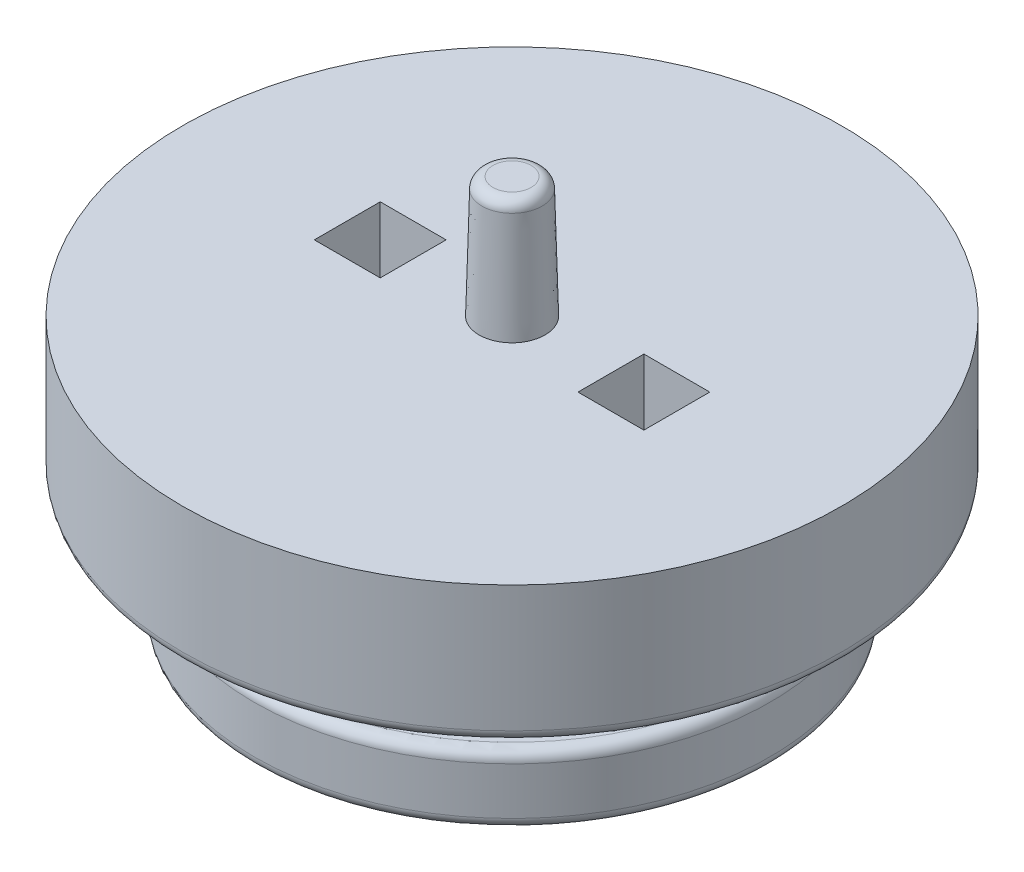
from build123d import *

# Parameters (mm, degrees)
SKETCH1_R           = 5.75
BOSS_EXTRUDE1_DEPTH = 15
SKETCH12_R          = 5.75
BOSS_EXTRUDE3_DEPTH = 2
SKETCH11_R          = 15
SKETCH11_W          = 3
SKETCH11_H          = 3
BOSS_EXTRUDE2_DEPTH = 4.25
SKETCH13_R          = 1.5
BOSS_EXTRUDE4_DEPTH = 5.5
BOSS_EXTRUDE4_TAPER = 1.5
FILLET2_R           = 0.5
BOSS_EXTRUDE5_START = -2
SKETCH11_2_R        = 15
BOSS_EXTRUDE5_DEPTH = 2
SKETCH14_R          = 11.75
BOSS_EXTRUDE6_DEPTH = 12.4
SKETCH14_2_R        = 11.75
CUT_EXTRUDE1_DEPTH  = 9.25
FILLET3_R           = 0.5


with BuildPart() as part:
    # Sketch1 → Boss-Extrude1 (new body)
    with BuildSketch(Plane(origin=(0, 0, 0), x_dir=(1, 0, 0), z_dir=(0, 1, 0))):
        with Locations(Location((0, 0, 0), (0, 0, 270))):
            Circle(SKETCH1_R)
    extrude(amount=BOSS_EXTRUDE1_DEPTH)

    # Sketch12 → Boss-Extrude3 (add)
    with BuildSketch(Plane(origin=(0, 15, 0), x_dir=(1, 0, 0), z_dir=(0, 1, 0))):
        with Locations(Location((0, 0, 0), (0, 0, 270))):
            Circle(SKETCH12_R)
    extrude(amount=BOSS_EXTRUDE3_DEPTH)

    # Sketch11 → Boss-Extrude2 (add)
    with BuildSketch(Plane(origin=(0, 17, 0), x_dir=(1, 0, 0), z_dir=(0, 1, 0))):
        with Locations(Location((0, 0, 0), (0, 0, 270))):
            Circle(SKETCH11_R)
        with Locations((-6, 0)):
            Rectangle(SKETCH11_W, SKETCH11_H, mode=Mode.SUBTRACT)
        with Locations((6, 0)):
            Rectangle(SKETCH11_W, SKETCH11_H, mode=Mode.SUBTRACT)
    extrude(amount=BOSS_EXTRUDE2_DEPTH)

    # Sketch13 → Boss-Extrude4 (add)
    with BuildSketch(Plane(origin=(0, 21.25, 0), x_dir=(1, 0, 0), z_dir=(0, 1, 0))):
        Circle(SKETCH13_R)
    extrude(amount=BOSS_EXTRUDE4_DEPTH, taper=BOSS_EXTRUDE4_TAPER)

    # Fillet2
    fillet2_edges = [part.edges().sort_by_distance(p)[0] for p in [
        (-1.355977431, 26.75, 0),
    ]]
    fillet(fillet2_edges, radius=FILLET2_R)

    # Sketch11<2> → Boss-Extrude5 (add)
    # profile 1 of 3: a face of its own
    with BuildSketch(Plane(origin=(0, 17, 0), x_dir=(1, 0, 0), z_dir=(0, 1, 0)).offset(BOSS_EXTRUDE5_START)):
        with Locations(Location((0, 0, 0), (0, 0, 270))):
            Circle(SKETCH11_2_R)
        with BuildLine():
            Line((-7.5, -1.5), (-7.5, 1.5))
            Line((-7.5, 1.5), (-5.550900828, 1.5))
            ThreePointArc((-5.550900828, 1.5), (0, 5.75), (5.550900828, 1.5))
            Line((5.550900828, 1.5), (7.5, 1.5))
            Line((7.5, 1.5), (7.5, -1.5))
            Line((7.5, -1.5), (5.550900828, -1.5))
            ThreePointArc((5.550900828, -1.5), (0, -5.75), (-5.550900828, -1.5))
            Line((-5.550900828, -1.5), (-7.5, -1.5))
        make_face(mode=Mode.SUBTRACT)
    # profile 2 of 3: a face of its own
    with BuildSketch(Plane(origin=(0, 17, 0), x_dir=(1, 0, 0), z_dir=(0, 1, 0)).offset(BOSS_EXTRUDE5_START)):
        with BuildLine():
            Line((7.5, 1.5), (5.550900828, 1.5))
            ThreePointArc((5.550900828, 1.5), (5.700007884, 0.756577901), (5.75, 0))
            ThreePointArc((5.75, 0), (5.700007884, -0.756577901), (5.550900828, -1.5))
            Line((5.550900828, -1.5), (7.5, -1.5))
            Line((7.5, -1.5), (7.5, 1.5))
        make_face()
    # profile 3 of 3: a face of its own
    with BuildSketch(Plane(origin=(0, 17, 0), x_dir=(1, 0, 0), z_dir=(0, 1, 0)).offset(BOSS_EXTRUDE5_START)):
        with BuildLine():
            Line((-5.550900828, 1.5), (-7.5, 1.5))
            Line((-7.5, 1.5), (-7.5, -1.5))
            Line((-7.5, -1.5), (-5.550900828, -1.5))
            ThreePointArc((-5.550900828, -1.5), (-5.75, 0), (-5.550900828, 1.5))
        make_face()
    extrude(amount=BOSS_EXTRUDE5_DEPTH)

    # Sketch14 → Boss-Extrude6 (add)
    with BuildSketch(Plane.XZ):
        with Locations(Location((0, 0, 0), (0, 0, 270))):
            Circle(SKETCH14_R)
    extrude(amount=-BOSS_EXTRUDE6_DEPTH)

    # Sketch14<2> → Cut-Extrude1 (cut)
    with BuildSketch(Plane.XZ):
        with Locations(Location((0, 0, 0), (0, 0, 270))):
            Circle(SKETCH14_2_R)
    extrude(amount=-CUT_EXTRUDE1_DEPTH, mode=Mode.SUBTRACT)

    # Fillet3
    fillet3_edges = [part.edges().sort_by_distance(p)[0] for p in [
        (0, 15, -15),
        (0, 12.4, 11.75),
        (0, 9.25, 11.75),
    ]]
    fillet(fillet3_edges, radius=FILLET3_R)


solid = part.part
